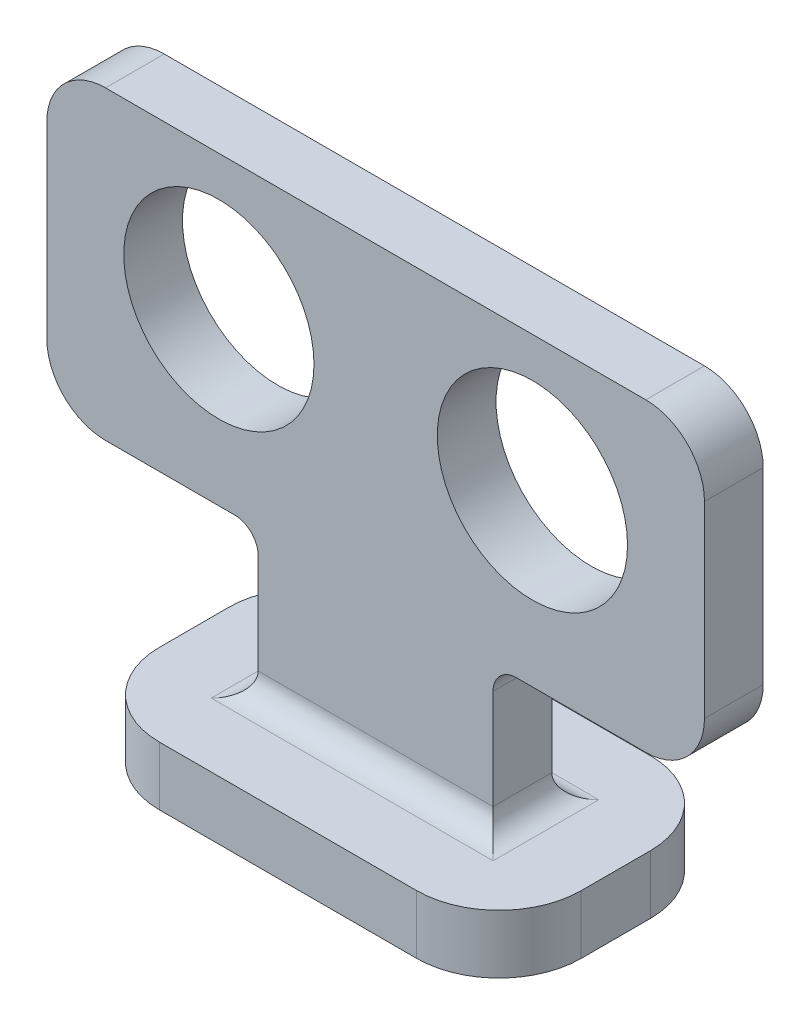
from build123d import *

# Parameters (mm, degrees)
SKETCH1_W           = 3
SKETCH1_H           = 23
SKETCH1_W_2         = 56
SKETCH1_H_2         = 3
BOSS_EXTRUDE1_DEPTH = 5
SKETCH7_W           = 20
SKETCH7_H           = 5
BOSS_EXTRUDE7_DEPTH = 12.5
SKETCH8_W           = 35.9
SKETCH8_H           = 19.9
BOSS_EXTRUDE8_DEPTH = 5
FILLET3_R           = 5
FILLET5_R           = 2
FILLET9_R           = 2
FILLET10_R          = 7


with BuildPart() as part:
    # Sketch1 → Boss-Extrude1 (new body)
    with BuildSketch(Plane.XY):
        with BuildLine():
            Line((50, 11.5), (46.45, 11.5))
            ThreePointArc((46.45, 11.5), (38.35, 3.4), (30.25, 11.5))
            Line((30.25, 11.5), (19.75, 11.5))
            ThreePointArc((19.75, 11.5), (11.65, 3.4), (3.55, 11.5))
            Line((3.55, 11.5), (0, 11.5))
            Line((0, 11.5), (0, 0))
            Line((0, 0), (50, 0))
            Line((50, 0), (50, 11.5))
        make_face()
        with BuildLine():
            ThreePointArc((30.25, 11.5), (38.35, 19.6), (46.45, 11.5))
            Line((46.45, 11.5), (50, 11.5))
            Line((50, 11.5), (50, 23))
            Line((50, 23), (0, 23))
            Line((0, 23), (0, 11.5))
            Line((0, 11.5), (3.55, 11.5))
            ThreePointArc((3.55, 11.5), (11.65, 19.6), (19.75, 11.5))
            Line((19.75, 11.5), (30.25, 11.5))
        make_face()
        with Locations((-1.5, 11.5)):
            Rectangle(SKETCH1_W, SKETCH1_H)
        with Locations((51.5, 11.5)):
            Rectangle(SKETCH1_W, SKETCH1_H)
        with Locations((25, -1.5)):
            Rectangle(SKETCH1_W_2, SKETCH1_H_2)
    extrude(amount=BOSS_EXTRUDE1_DEPTH)

    # Sketch7 → Boss-Extrude7 (add)
    with BuildSketch(Plane.XZ.offset(3)):
        with Locations((25, 2.5)):
            Rectangle(SKETCH7_W, SKETCH7_H)
    extrude(amount=BOSS_EXTRUDE7_DEPTH)

    # Sketch8 → Boss-Extrude8 (add)
    with BuildSketch(Plane.XZ.offset(15.5)):
        with Locations((25, 2.5)):
            Rectangle(SKETCH8_W, SKETCH8_H)
    extrude(amount=BOSS_EXTRUDE8_DEPTH)

    # Fillet3
    fillet3_edges = [part.edges().sort_by_distance(p)[0] for p in [
        (53, 23, 2.5),
        (-3, 23, 2.5),
        (53, -3, 2.5),
        (-3, -3, 2.5),
    ]]
    fillet(fillet3_edges, radius=FILLET3_R)

    # Fillet5
    fillet5_edges = [part.edges().sort_by_distance(p)[0] for p in [
        (35, -3, 2.5),
        (15, -3, 2.5),
    ]]
    fillet(fillet5_edges, radius=FILLET5_R)

    # Fillet9
    fillet9_edges = [part.edges().sort_by_distance(p)[0] for p in [
        (35, -15.5, 2.5),
        (25, -15.5, 5),
        (15, -15.5, 2.5),
        (25, -15.5, 0),
    ]]
    fillet(fillet9_edges, radius=FILLET9_R)

    # Fillet10
    fillet10_edges = [part.edges().sort_by_distance(p)[0] for p in [
        (42.95, -18, -7.45),
        (42.95, -18, 12.45),
        (7.05, -18, 12.45),
        (7.05, -18, -7.45),
    ]]
    fillet(fillet10_edges, radius=FILLET10_R)


solid = part.part
